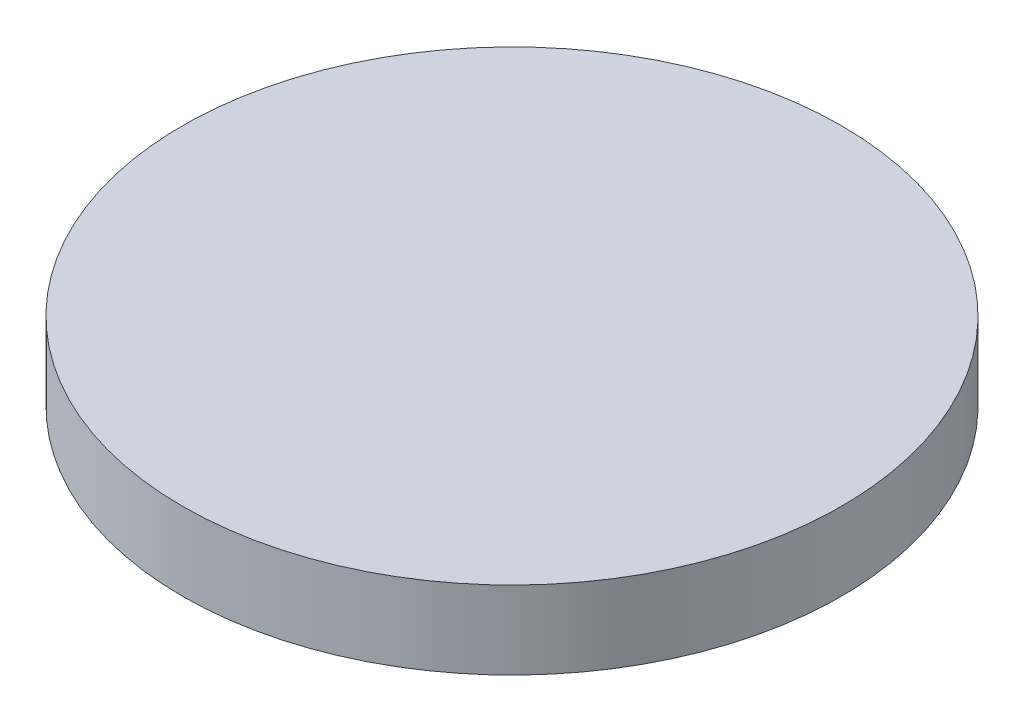
from build123d import *

# Parameters (mm, degrees)
SKETCH_1_R      = 46.5
EXTRUDE_1_DEPTH = 6
EXTRUDE_START   = 5
SKETCH_2_R      = 46.5
SKETCH_2_R_2    = 41.5
EXTRUDE_2_DEPTH = 5


with BuildPart() as part:
    # Эскиз1 → Бобышка-Вытянуть1 (new body)
    with BuildSketch(Plane(origin=(0, 0, 0), x_dir=(1, 0, 0), z_dir=(0, 1, 0))):
        with Locations(Location((0, 0, 0), (0, 0, 270))):
            Circle(SKETCH_1_R)
    extrude(amount=EXTRUDE_1_DEPTH)

    # Эскиз2 → Бобышка-Вытянуть2 (add)
    with BuildSketch(Plane.XZ.offset(EXTRUDE_START)):
        with Locations(Location((0, 0, 0), (0, 0, 270))):
            Circle(SKETCH_2_R)
        with Locations(Location((0, 0, 0), (0, 0, 270))):
            Circle(SKETCH_2_R_2, mode=Mode.SUBTRACT)
    extrude(amount=-EXTRUDE_2_DEPTH)


solid = part.part
